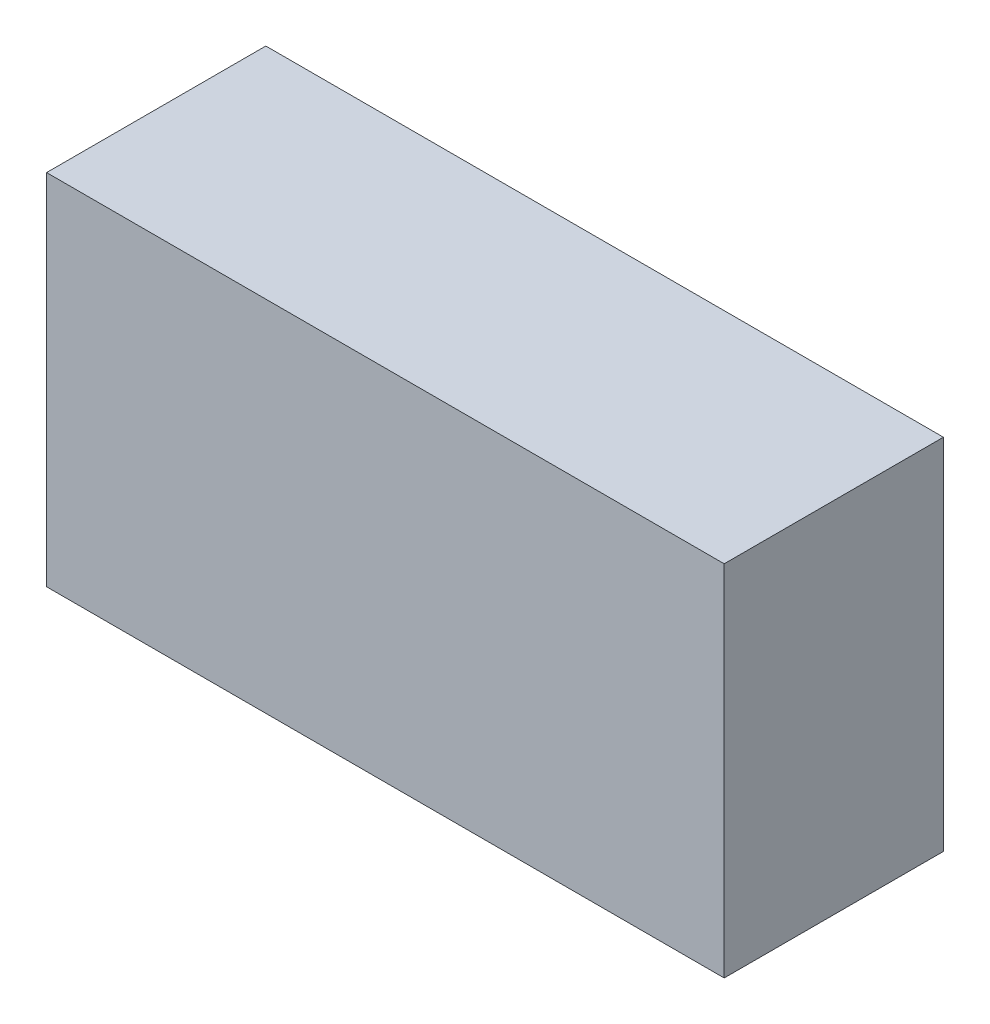
from build123d import *

# Parameters (mm, degrees)
SKETCH1_W           = 34
SKETCH1_H           = 18
BOSS_EXTRUDE1_DEPTH = 11


with BuildPart() as part:
    # Sketch1 → Boss-Extrude1 (new body)
    with BuildSketch(Plane.XY):
        with Locations((20, 14)):
            Rectangle(SKETCH1_W, SKETCH1_H)
    extrude(amount=BOSS_EXTRUDE1_DEPTH)


solid = part.part
